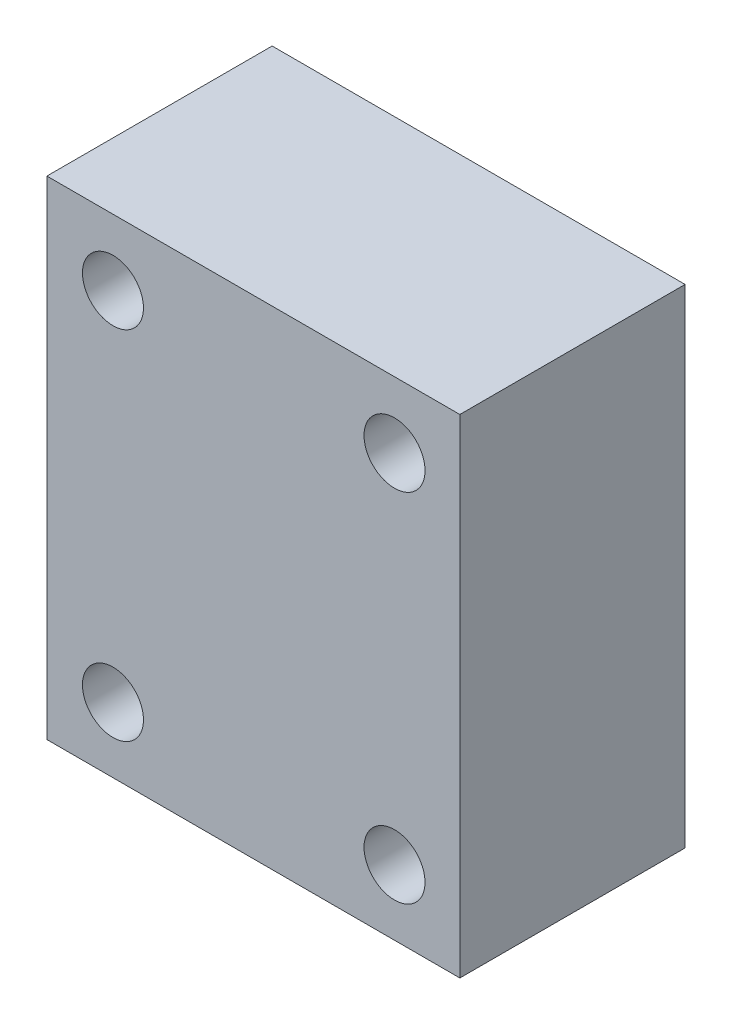
from build123d import *

# Parameters (mm, degrees)
SKETCH1_W           = 82.55
SKETCH1_H           = 69.85
BOSS_EXTRUDE1_DEPTH = 19.05
CUT_EXTRUDE2_START  = -19.05
SKETCH2_R           = 5.159375
CUT_EXTRUDE2_DEPTH  = 38.1
CUT_EXTRUDE4_START  = -19.05
SKETCH3_R           = 5.159375
CUT_EXTRUDE4_DEPTH  = 38.1
CUT_EXTRUDE6_START  = -19.05
SKETCH4_R           = 7.3421875
CUT_EXTRUDE6_DEPTH  = 28.448
CUT_EXTRUDE8_START  = -19.05
SKETCH5_R           = 12.7254
CUT_EXTRUDE8_DEPTH  = 2.8194
CUT_EXTRUDE10_START = -19.05
SKETCH6_R           = 7.3421875
CUT_EXTRUDE10_DEPTH = 28.448
CUT_EXTRUDE12_START = -19.05
SKETCH7_R           = 12.7254
CUT_EXTRUDE12_DEPTH = 2.8194


with BuildPart() as part:
    # Sketch1 → Boss-Extrude1 (new, symmetric)
    with BuildSketch(Plane(origin=(0, 0, 0), x_dir=(0, 1, 0), z_dir=(0, 0, 1))):
        Rectangle(SKETCH1_W, SKETCH1_H)
    extrude(amount=BOSS_EXTRUDE1_DEPTH, both=True)

    # Sketch2 → Cut-Extrude2 (cut)
    with BuildSketch(Plane(origin=(0, 0, 0), x_dir=(0, 1, 0), z_dir=(0, 0, 1)).offset(CUT_EXTRUDE2_START)):
        with Locations(Location((-30.226, -23.876, 0), (0, 0, 90))):
            Circle(SKETCH2_R)
    extrude(amount=CUT_EXTRUDE2_DEPTH, mode=Mode.SUBTRACT)

    # Sketch3 → Cut-Extrude4 (cut)
    with BuildSketch(Plane(origin=(0, 0, 0), x_dir=(0, 1, 0), z_dir=(0, 0, 1)).offset(CUT_EXTRUDE4_START)):
        with Locations(Location((30.099, -23.876, 0), (0, 0, 90))):
            Circle(SKETCH3_R)
        with Locations(Location((-30.226, 23.749, 0), (0, 0, 90))):
            Circle(SKETCH3_R)
        with Locations(Location((30.099, 23.749, 0), (0, 0, 90))):
            Circle(SKETCH3_R)
    extrude(amount=CUT_EXTRUDE4_DEPTH, mode=Mode.SUBTRACT)

    # Sketch4 → Cut-Extrude6 (cut)
    with BuildSketch(Plane(origin=(0, 0, 0), x_dir=(0, 1, 0), z_dir=(0, 0, 1)).offset(CUT_EXTRUDE6_START)):
        with Locations(Location((-17.653, 0, 0), (0, 0, 270))):
            Circle(SKETCH4_R)
    extrude(amount=CUT_EXTRUDE6_DEPTH, mode=Mode.SUBTRACT)

    # Sketch5 → Cut-Extrude8 (cut)
    with BuildSketch(Plane(origin=(0, 0, 0), x_dir=(0, 1, 0), z_dir=(0, 0, 1)).offset(CUT_EXTRUDE8_START)):
        with Locations(Location((-17.653, 0, 0), (0, 0, 270))):
            Circle(SKETCH5_R)
    extrude(amount=CUT_EXTRUDE8_DEPTH, mode=Mode.SUBTRACT)

    # Sketch6 → Cut-Extrude10 (cut)
    with BuildSketch(Plane(origin=(0, 0, 0), x_dir=(0, 1, 0), z_dir=(0, 0, 1)).offset(CUT_EXTRUDE10_START)):
        with Locations(Location((17.399, 0, 0), (0, 0, 270))):
            Circle(SKETCH6_R)
    extrude(amount=CUT_EXTRUDE10_DEPTH, mode=Mode.SUBTRACT)

    # Sketch7 → Cut-Extrude12 (cut)
    with BuildSketch(Plane(origin=(0, 0, 0), x_dir=(0, 1, 0), z_dir=(0, 0, 1)).offset(CUT_EXTRUDE12_START)):
        with Locations(Location((17.399, 0, 0), (0, 0, 270))):
            Circle(SKETCH7_R)
    extrude(amount=CUT_EXTRUDE12_DEPTH, mode=Mode.SUBTRACT)


solid = part.part
